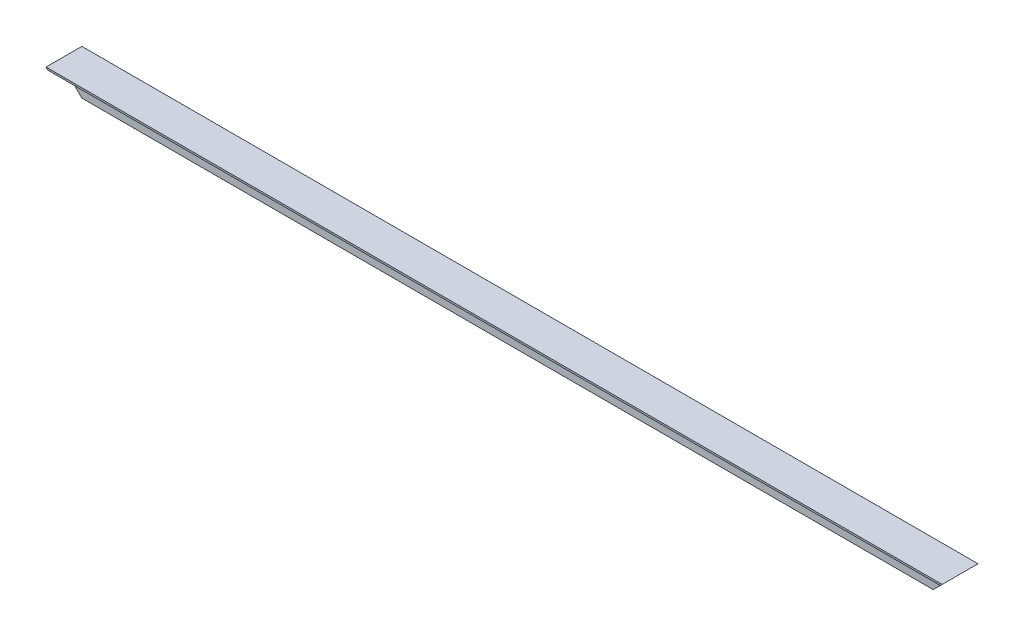
from build123d import *

# Parameters (mm, degrees)
SKETCH6_W           = 1000
SKETCH6_H           = 40
BOSS_EXTRUDE3_DEPTH = 40
SKETCH7_W           = 15
SKETCH7_H           = 23
CUT_EXTRUDE3_DEPTH  = 1064
CUT_EXTRUDE4_DEPTH  = 1064


with BuildPart() as part:
    # Sketch6 → Boss-Extrude3 (new body)
    with BuildSketch(Plane.XY):
        with Locations((439.141785032, 79.78108724)):
            Rectangle(SKETCH6_W, SKETCH6_H)
    extrude(amount=BOSS_EXTRUDE3_DEPTH)

    # Sketch7 → Cut-Extrude3 (cut)
    with BuildSketch(Plane.ZY.offset(60.858214968)):
        with Locations((32.5, 86.28108724)):
            Rectangle(SKETCH7_W, SKETCH7_H)
        Polygon((25, 74.78108724), (2, 74.78108724), (2, 59.78108724), (40, 59.78108724), (40, 74.78108724), align=None)
    extrude(amount=-CUT_EXTRUDE3_DEPTH, mode=Mode.SUBTRACT)

    # Sketch8 → Cut-Extrude4 (cut)
    with BuildSketch(Plane(origin=(0, 0, 0), x_dir=(-1, 0, 0), z_dir=(0, 0, -1))):
        Polygon((-939.141785032, 99.78108724), (-899.141785032, 59.78108724), (-939.141785032, 59.78108724), align=None)
        Polygon((60.858214968, 59.78108724), (20.858214968, 59.78108724), (60.858214968, 99.78108724), align=None)
    extrude(amount=-CUT_EXTRUDE4_DEPTH, mode=Mode.SUBTRACT)


solid = part.part
